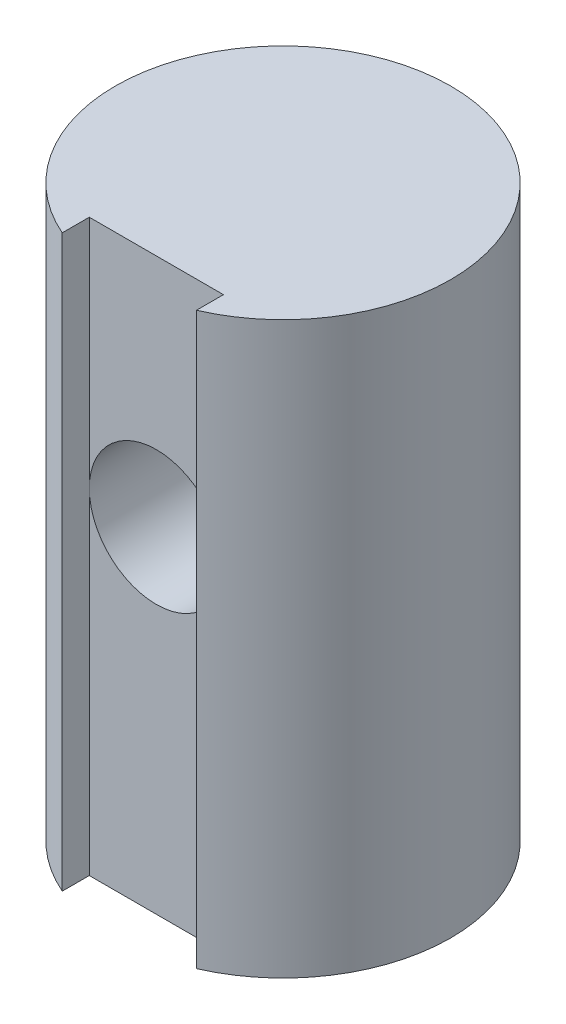
from build123d import *

# Parameters (mm, degrees)
SKETCH1_R           = 15.875
CYLINDER_DEPTH      = 53.975
SKETCH2_W           = 12.7
SKETCH2_H           = 12.7
FLUE_TRACK_DEPTH    = 76.2
AIR_DUCT_DEPTH      = 59.45794963
AIR_DUCT_DEPTH_BACK = 59.45794963
SKETCH3_R           = 6.35


with BuildPart() as part:
    # Sketch1 → cylinder (new body)
    with BuildSketch(Plane(origin=(0, 0, 0), x_dir=(1, 0, 0), z_dir=(0, 1, 0))):
        with Locations(Location((0, 0, 0), (0, 0, 270))):
            Circle(SKETCH1_R)
    extrude(amount=CYLINDER_DEPTH)

    # Sketch2 → flue track (cut)
    with BuildSketch(Plane(origin=(0, 53.975, 0), x_dir=(1, 0, 0), z_dir=(0, 1, 0))):
        with Locations((0, -18.3388)):
            Rectangle(SKETCH2_W, SKETCH2_H)
    extrude(amount=-FLUE_TRACK_DEPTH, mode=Mode.SUBTRACT)

    # Sketch3 → air duct (cut, two sides: drawn at the far end of the back side and taken through both)
    with BuildSketch(Plane.XY.offset(-AIR_DUCT_DEPTH_BACK)):
        with Locations((0, 31.75)):
            Circle(SKETCH3_R)
    extrude(amount=AIR_DUCT_DEPTH + AIR_DUCT_DEPTH_BACK, mode=Mode.SUBTRACT)


solid = part.part
